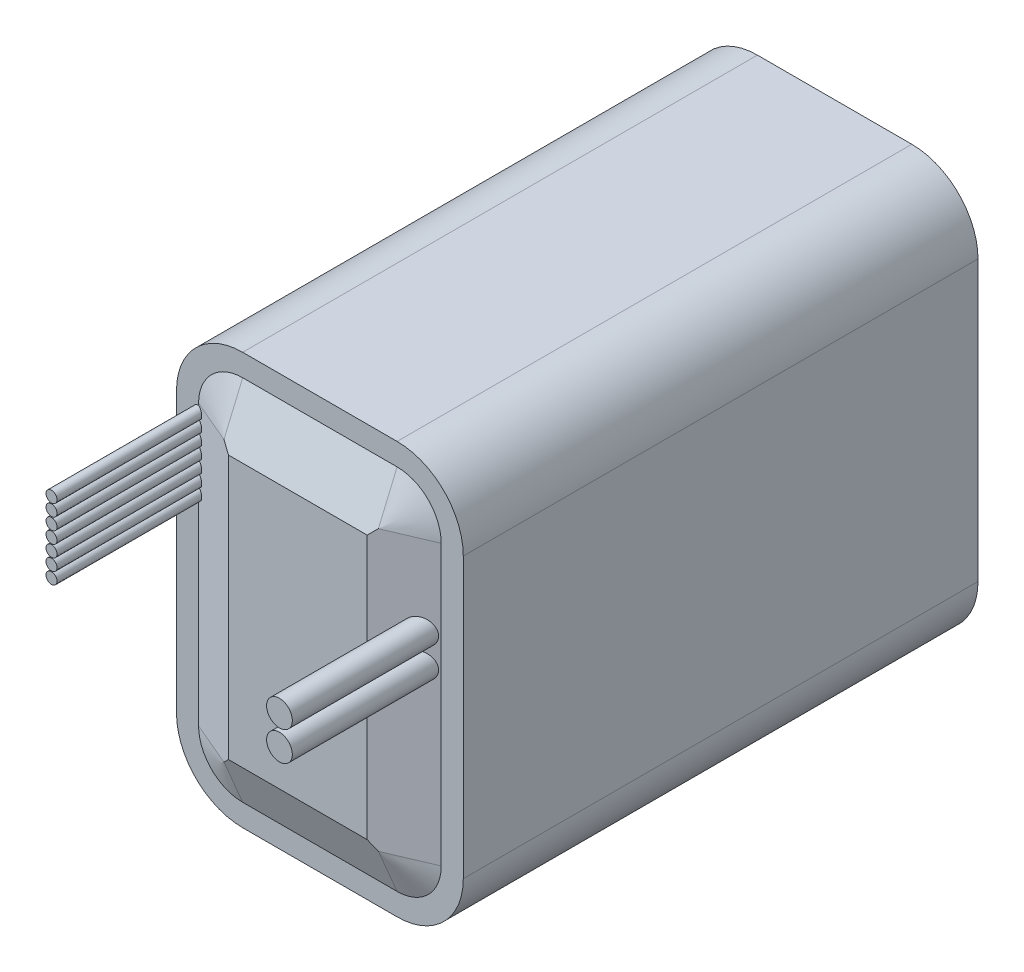
from build123d import *

# Parameters (mm, degrees)
BOSS_EXTRUDE1_DEPTH = 70
BOSS_EXTRUDE2_DEPTH = 3
BOSS_EXTRUDE2_TAPER = 67
SKETCH3_R           = 1.75
SKETCH3_R_2         = 0.75
BOSS_EXTRUDE3_DEPTH = 20


with BuildPart() as part:
    # Sketch1 → Boss-Extrude1 (new body)
    with BuildSketch(Plane(origin=(0, 0, 0), x_dir=(0, 1, 0), z_dir=(0, 0, 1))):
        with BuildLine():
            Line((-19, 19.5), (19, 19.5))
            ThreePointArc((19, 19.5), (25.363961031, 16.863961031), (28, 10.5))
            Line((28, 10.5), (28, -10.5))
            ThreePointArc((28, -10.5), (25.363961031, -16.863961031), (19, -19.5))
            Line((19, -19.5), (-19, -19.5))
            ThreePointArc((-19, -19.5), (-25.363961031, -16.863961031), (-28, -10.5))
            Line((-28, -10.5), (-28, 10.5))
            ThreePointArc((-28, 10.5), (-25.363961031, 16.863961031), (-19, 19.5))
        make_face()
    extrude(amount=BOSS_EXTRUDE1_DEPTH)

    # Sketch2 → Boss-Extrude2 (add)
    with BuildSketch(Plane.XY.offset(70)):
        with BuildLine():
            Line((10.5, 25), (-10.5, 25))
            ThreePointArc((-10.5, 25), (-14.742640687, 23.242640687), (-16.5, 19))
            Line((-16.5, 19), (-16.5, -19))
            ThreePointArc((-16.5, -19), (-14.742640687, -23.242640687), (-10.5, -25))
            Line((-10.5, -25), (10.5, -25))
            ThreePointArc((10.5, -25), (14.742640687, -23.242640687), (16.5, -19))
            Line((16.5, -19), (16.5, 19))
            ThreePointArc((16.5, 19), (14.742640687, 23.242640687), (10.5, 25))
        make_face()
    extrude(amount=BOSS_EXTRUDE2_DEPTH, taper=BOSS_EXTRUDE2_TAPER)

    # Sketch3 → Boss-Extrude3 (add)
    with BuildSketch(Plane.XY.offset(70)):
        with Locations((14.5, 8)):
            Circle(SKETCH3_R)
        with Locations((14.5, 4)):
            Circle(SKETCH3_R)
        with Locations(Location((-16.5, 18, 0), (0, 0, 270))):
            Circle(SKETCH3_R_2)
        with Locations(Location((-16.5, 16.4, 0), (0, 0, 270))):
            Circle(SKETCH3_R_2)
        with Locations(Location((-16.5, 14.8, 0), (0, 0, 270))):
            Circle(SKETCH3_R_2)
        with Locations(Location((-16.5, 13.2, 0), (0, 0, 270))):
            Circle(SKETCH3_R_2)
        with Locations(Location((-16.5, 11.6, 0), (0, 0, 270))):
            Circle(SKETCH3_R_2)
        with Locations(Location((-16.5, 10, 0), (0, 0, 270))):
            Circle(SKETCH3_R_2)
        with Locations(Location((-16.5, 8.4, 0), (0, 0, 270))):
            Circle(SKETCH3_R_2)
    extrude(amount=BOSS_EXTRUDE3_DEPTH)


solid = part.part
